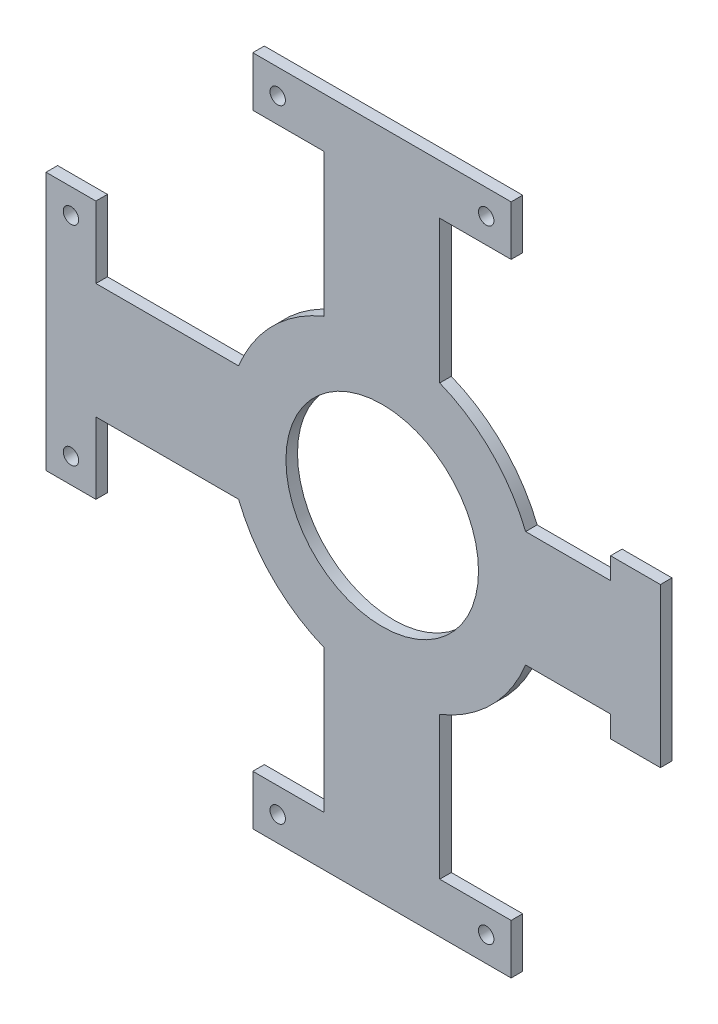
from build123d import *

# Parameters (mm, degrees)
CROQUIS1_R              = 25
SALIENTE_EXTRUIR1_DEPTH = 3
CROQUIS2_W              = 12.95
CROQUIS2_H              = 12.95
SALIENTE_EXTRUIR2_DEPTH = 3
CROQUIS3_R              = 2
CORTAR_EXTRUIR1_DEPTH   = 124.455998815


with BuildPart() as part:
    # Croquis1 → Saliente-Extruir1 (new body)
    with BuildSketch(Plane.XY):
        with BuildLine():
            Line((-15.070986718, 74.306476298), (-15.070986718, 37.256476298))
            ThreePointArc((-15.070986718, 37.256476298), (-28.445175059, 28.391049341), (-37.285113206, 15))
            Line((-37.285113206, 15), (-74.335113206, 15))
            Line((-74.335113206, 15), (-74.335113206, 20.59))
            Line((-74.335113206, 20.59), (-87.285113206, 20.59))
            Line((-87.285113206, 20.59), (-87.285113206, -20.59))
            Line((-87.285113206, -20.59), (-74.335113206, -20.59))
            Line((-74.335113206, -20.59), (-74.335113206, -15))
            Line((-74.335113206, -15), (-37.285113206, -15))
            ThreePointArc((-37.285113206, -15), (-28.445175059, -28.391049341), (-15.070986718, -37.256476298))
            Line((-15.070986718, -37.256476298), (-15.070986718, -74.306476298))
            Line((-15.070986718, -74.306476298), (-20.660986718, -74.306476298))
            Line((-20.660986718, -74.306476298), (-20.660986718, -87.256476298))
            Line((-20.660986718, -87.256476298), (20.519013282, -87.256476298))
            Line((20.519013282, -87.256476298), (20.519013282, -74.306476298))
            Line((20.519013282, -74.306476298), (14.929013282, -74.306476298))
            Line((14.929013282, -74.306476298), (14.929013282, -37.256476298))
            ThreePointArc((14.929013282, -37.256476298), (28.353570497, -28.407666286), (37.22795272, -15))
            Line((37.22795272, -15), (59.27795272, -15))
            Line((59.27795272, -15), (59.27795272, -20.59))
            Line((59.27795272, -20.59), (72.22795272, -20.59))
            Line((72.22795272, -20.59), (72.22795272, 20.59))
            Line((72.22795272, 20.59), (59.27795272, 20.59))
            Line((59.27795272, 20.59), (59.27795272, 15))
            Line((59.27795272, 15), (37.22795272, 15))
            ThreePointArc((37.22795272, 15), (28.353570497, 28.407666286), (14.929013282, 37.256476298))
            Line((14.929013282, 37.256476298), (14.929013282, 74.306476298))
            Line((14.929013282, 74.306476298), (20.519013282, 74.306476298))
            Line((20.519013282, 74.306476298), (20.519013282, 87.256476298))
            Line((20.519013282, 87.256476298), (-20.660986718, 87.256476298))
            Line((-20.660986718, 87.256476298), (-20.660986718, 74.306476298))
            Line((-20.660986718, 74.306476298), (-15.070986718, 74.306476298))
        make_face()
        Circle(CROQUIS1_R, mode=Mode.SUBTRACT)
    extrude(amount=SALIENTE_EXTRUIR1_DEPTH)

    # Croquis2 → Saliente-Extruir2 (add)
    with BuildSketch(Plane(origin=(0, 0, 0), x_dir=(-1, 0, 0), z_dir=(0, 0, -1))):
        with Locations((-26.994013282, 80.781476298)):
            Rectangle(CROQUIS2_W, CROQUIS2_H)
        with Locations((27.135986718, 80.781476298)):
            Rectangle(CROQUIS2_W, CROQUIS2_H)
        with Locations((-26.994013282, -80.781476298)):
            Rectangle(CROQUIS2_W, CROQUIS2_H)
        with Locations((27.135986718, -80.781476298)):
            Rectangle(CROQUIS2_W, CROQUIS2_H)
        with Locations((80.810113206, 27.065)):
            Rectangle(CROQUIS2_W, CROQUIS2_H)
        with Locations((80.810113206, -27.065)):
            Rectangle(CROQUIS2_W, CROQUIS2_H)
    extrude(amount=-SALIENTE_EXTRUIR2_DEPTH)

    # Croquis3 → Cortar-Extruir1 (cut, through all)
    with BuildSketch(Plane(origin=(0, 0, 0), x_dir=(-1, 0, 0), z_dir=(0, 0, -1))):
        with Locations((-26.994013282, 80.781476298)):
            Circle(CROQUIS3_R)
        with Locations((27.135986718, 80.781476298)):
            Circle(CROQUIS3_R)
        with Locations((27.135986718, -80.781476298)):
            Circle(CROQUIS3_R)
        with Locations((-26.994013282, -80.781476298)):
            Circle(CROQUIS3_R)
        with Locations((80.810113206, -27.065)):
            Circle(CROQUIS3_R)
        with Locations((80.810113206, 27.065)):
            Circle(CROQUIS3_R)
    extrude(amount=-CORTAR_EXTRUIR1_DEPTH, mode=Mode.SUBTRACT)


solid = part.part
